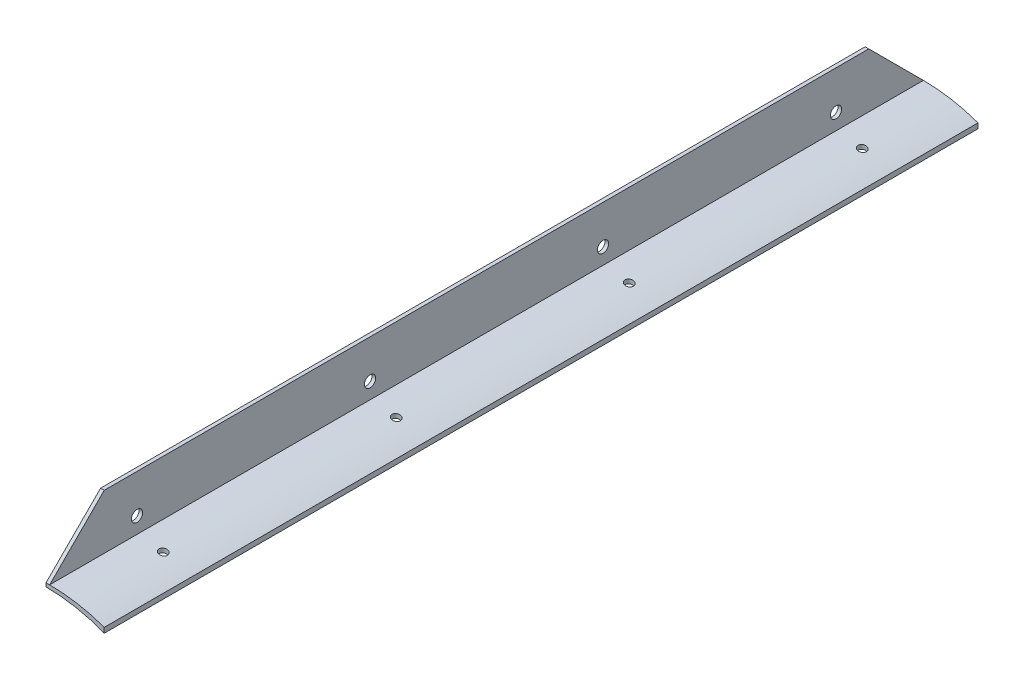
from build123d import *

# Parameters (mm, degrees)
EXTRUDE1_DEPTH               = 190.5
EXTRUDE2_DEPTH               = 387.35
F_6_CLEARANCE_HOLE1_D        = 3.6576
F_10_0_1935_DIAMETER_HOLE1_D = 4.9149
LPATTERN1_COUNT              = 3
LPATTERN1_PITCH              = 101.6
LPATTERN1_COL_COUNT          = 2
LPATTERN1_COL_PITCH          = 101.6


with BuildPart() as part:
    # Sketch1 → Extrude1 (new, symmetric)
    with BuildSketch(Plane.XY):
        with BuildLine():
            Line((0, 0), (0, 25.4))
            Line((0, 25.4), (1.5875, 25.4))
            Line((1.5875, 25.4), (1.5875, 1.5875))
            ThreePointArc((1.5875, 1.5875), (13.671867582, 0.546246178), (25.4, -2.546820159))
            Line((25.4, -2.546820159), (25.4, -4.781862636))
            ThreePointArc((25.4, -4.781862636), (12.923101507, -1.205874633), (0, 0))
        make_face()
    extrude(amount=EXTRUDE1_DEPTH, both=True)

    # Sketch2 → Extrude2 (cut)
    with BuildSketch(Plane.ZY):
        Polygon((190.5, 25.4), (166.6875, 25.4), (190.5, 1.5875), align=None)
    extrude2 = extrude(amount=-EXTRUDE2_DEPTH, mode=Mode.SUBTRACT)

    # Mirror2: Extrude2 across plane
    add(extrude2.mirror(Plane(origin=(0, 0, 0), x_dir=(1, 0, 0), z_dir=(0, 0, -1))), mode=Mode.SUBTRACT)

    # #6 Clearance Hole1 (through all)
    with Locations(Plane(origin=(0, 1.5875, 0), x_dir=(-1, 0, 0), z_dir=(0, 1, 0))):
        with Locations((-13.0175, -50.8)):
            f_6_clearance_hole1 = Hole(F_6_CLEARANCE_HOLE1_D / 2)

    # #10 (0.1935) Diameter Hole1 (through all)
    with Locations(Plane(origin=(1.5875, 8.5725, -50.8), x_dir=(0, 1, 0), z_dir=(1, 0, 0))):
        with Locations((0, 0)):
            f_10_0_1935_diameter_hole1 = Hole(F_10_0_1935_DIAMETER_HOLE1_D / 2)

    # LPattern1: #6 Clearance Hole1, #10 (0.1935) Diameter Hole1 ×3
    with Locations(*[(0, 0, i * LPATTERN1_PITCH) for i in range(1, LPATTERN1_COUNT)]):
        add(f_6_clearance_hole1, mode=Mode.SUBTRACT)
        add(f_10_0_1935_diameter_hole1, mode=Mode.SUBTRACT)

    # LPattern1 col: #6 Clearance Hole1, #10 (0.1935) Diameter Hole1 ×2
    with Locations(*[(0, 0, -i * LPATTERN1_COL_PITCH) for i in range(1, LPATTERN1_COL_COUNT)]):
        add(f_6_clearance_hole1, mode=Mode.SUBTRACT)
        add(f_10_0_1935_diameter_hole1, mode=Mode.SUBTRACT)


solid = part.part
